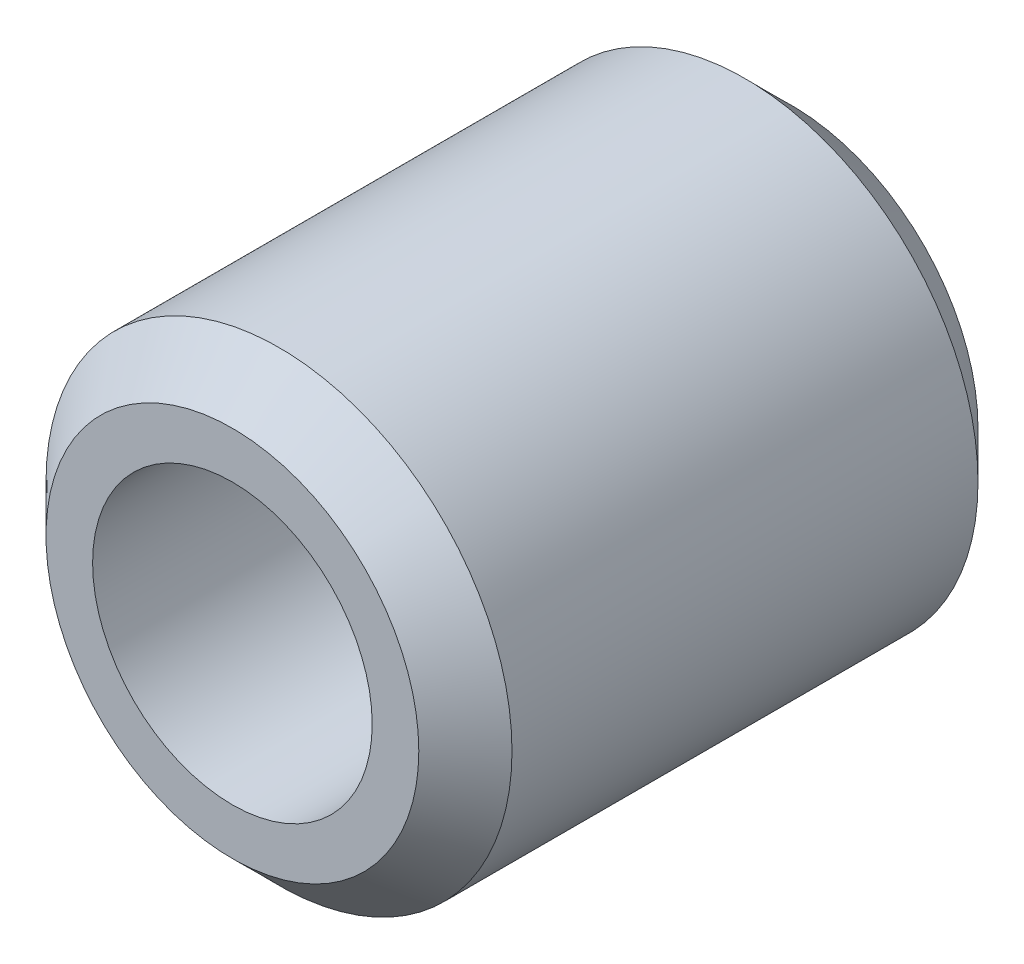
from build123d import *

# Parameters (mm, degrees)
SKETCH1_R           = 4.7625
BOSS_EXTRUDE1_DEPTH = 19.05
SKETCH2_R           = 7.9375
BOSS_EXTRUDE2_DEPTH = 19.05
SKETCH3_R           = 4.7625
CUT_EXTRUDE1_DEPTH  = 12.7
CHAMFER1_SIZE       = 1.5875


with BuildPart() as part:
    # Sketch1 → Boss-Extrude1 (new body)
    with BuildSketch(Plane.XY):
        Circle(SKETCH1_R)
    extrude(amount=-BOSS_EXTRUDE1_DEPTH)

    # Sketch2 → Boss-Extrude2 (add)
    with BuildSketch(Plane.XY):
        Circle(SKETCH2_R)
    extrude(amount=-BOSS_EXTRUDE2_DEPTH)

    # Sketch3 → Cut-Extrude1 (cut)
    with BuildSketch(Plane.XY):
        Circle(SKETCH3_R)
    extrude(amount=-CUT_EXTRUDE1_DEPTH, mode=Mode.SUBTRACT)

    # Chamfer1
    chamfer1_edges = [part.edges().sort_by_distance(p)[0] for p in [
        (-7.9375, 0, -19.05),
        (-7.9375, 0, 0),
    ]]
    chamfer(chamfer1_edges, length=CHAMFER1_SIZE)


solid = part.part
